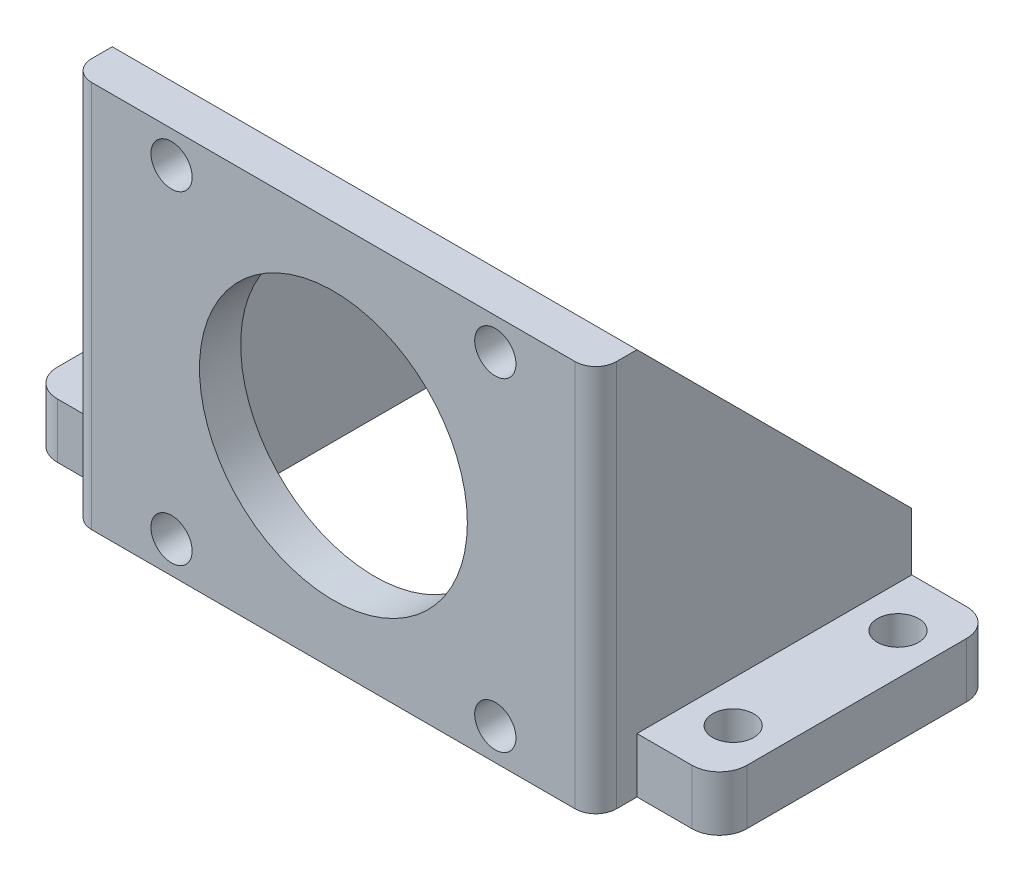
from build123d import *

# Parameters (mm, degrees)
SKETCH1_W           = 76.4
SKETCH1_H           = 56.4
SKETCH1_R           = 19.5
SKETCH1_R_2         = 3
BOSS_EXTRUDE1_DEPTH = 6
SKETCH2_W           = 9.5
SKETCH2_H           = 56.4
BOSS_EXTRUDE2_DEPTH = 40
FILLET1_R           = 3
SKETCH3_W           = 40
SKETCH3_H           = 8
BOSS_EXTRUDE3_DEPTH = 12
SKETCH4_W           = 40
SKETCH4_H           = 8
BOSS_EXTRUDE4_DEPTH = 12
FILLET2_R           = 4
SKETCH5_R           = 3
CUT_EXTRUDE1_DEPTH  = 12
CHAMFER1_SIZE       = 40


with BuildPart() as part:
    # Sketch1 → Boss-Extrude1 (new body)
    with BuildSketch(Plane.XY):
        with Locations((38.2, 28.2)):
            Rectangle(SKETCH1_W, SKETCH1_H)
        with Locations((38.2, 28.2)):
            Circle(SKETCH1_R, mode=Mode.SUBTRACT)
        with Locations((14.63, 51.77)):
            Circle(SKETCH1_R_2, mode=Mode.SUBTRACT)
        with Locations((61.77, 51.77)):
            Circle(SKETCH1_R_2, mode=Mode.SUBTRACT)
        with Locations((61.77, 4.63)):
            Circle(SKETCH1_R_2, mode=Mode.SUBTRACT)
        with Locations((14.63, 4.63)):
            Circle(SKETCH1_R_2, mode=Mode.SUBTRACT)
    extrude(amount=BOSS_EXTRUDE1_DEPTH)

    # Sketch2 → Boss-Extrude2 (add)
    with BuildSketch(Plane(origin=(0, 0, 0), x_dir=(-1, 0, 0), z_dir=(0, 0, -1))):
        with Locations((-71.65, 28.2)):
            Rectangle(SKETCH2_W, SKETCH2_H)
        with Locations((-4.75, 28.2)):
            Rectangle(SKETCH2_W, SKETCH2_H)
    extrude(amount=BOSS_EXTRUDE2_DEPTH)

    # Fillet1
    fillet1_edges = [part.edges().sort_by_distance(p)[0] for p in [
        (76.4, 28.2, 6),
        (0, 28.2, 6),
    ]]
    fillet(fillet1_edges, radius=FILLET1_R)

    # Sketch3 → Boss-Extrude3 (add)
    with BuildSketch(Plane.ZY):
        with Locations((-20, 4)):
            Rectangle(SKETCH3_W, SKETCH3_H)
    extrude(amount=BOSS_EXTRUDE3_DEPTH)

    # Sketch4 → Boss-Extrude4 (add)
    with BuildSketch(Plane(origin=(76.4, 0, 0), x_dir=(0, 0, -1), z_dir=(1, 0, 0))):
        with Locations((20, 4)):
            Rectangle(SKETCH4_W, SKETCH4_H)
    extrude(amount=BOSS_EXTRUDE4_DEPTH)

    # Fillet2
    fillet2_edges = [part.edges().sort_by_distance(p)[0] for p in [
        (-12, 4, -40),
        (-12, 4, 0),
        (88.4, 4, 0),
        (88.4, 4, -40),
    ]]
    fillet(fillet2_edges, radius=FILLET2_R)

    # Sketch5 → Cut-Extrude1 (cut)
    with BuildSketch(Plane(origin=(0, 8, 0), x_dir=(1, 0, 0), z_dir=(0, 1, 0))):
        with Locations(Location((-6, 32, 0), (0, 0, 270))):
            Circle(SKETCH5_R)
        with Locations(Location((-6, 8, 0), (0, 0, 270))):
            Circle(SKETCH5_R)
        with Locations(Location((82.4, 32, 0), (0, 0, 270))):
            Circle(SKETCH5_R)
        with Locations(Location((82.4, 8, 0), (0, 0, 270))):
            Circle(SKETCH5_R)
    extrude(amount=-CUT_EXTRUDE1_DEPTH, mode=Mode.SUBTRACT)

    # Chamfer1
    chamfer1_edges = [part.edges().sort_by_distance(p)[0] for p in [
        (4.75, 56.4, -40),
        (71.65, 56.4, -40),
    ]]
    chamfer(chamfer1_edges, length=CHAMFER1_SIZE)


solid = part.part
